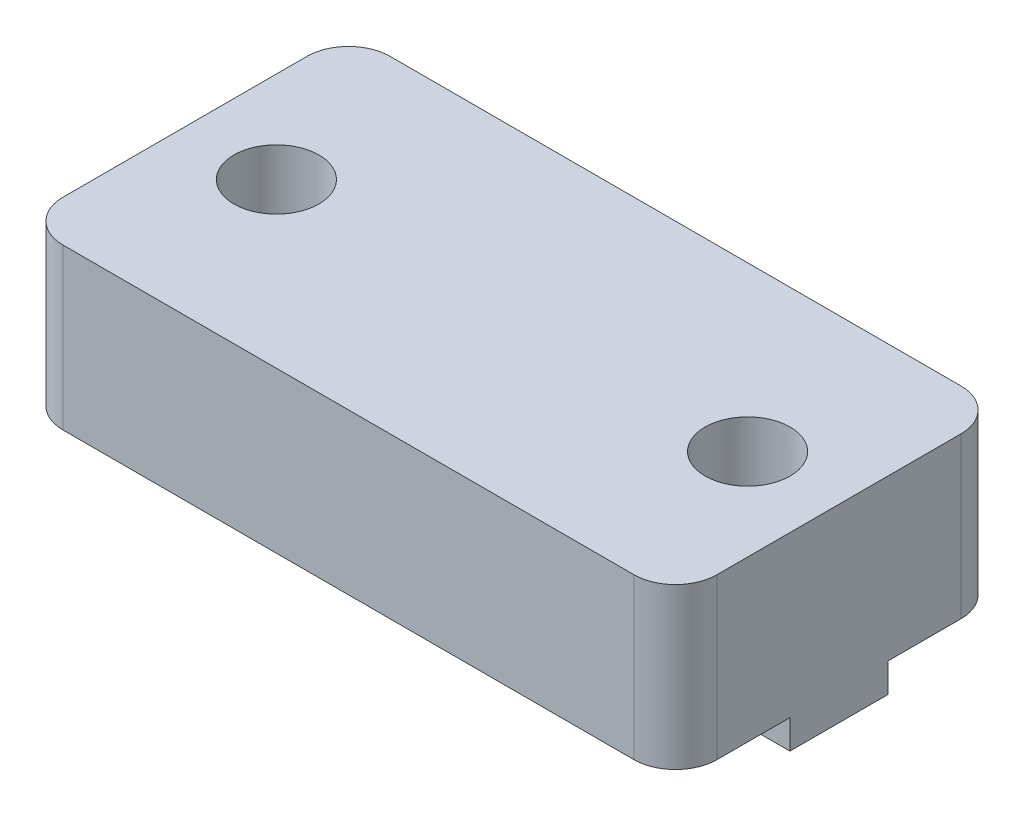
from build123d import *

# Parameters (mm, degrees)
BOSS_EXTRUDE1_DEPTH = 20
SKETCH2_R           = 2.6
CUT_EXTRUDE1_DEPTH  = 11.578
FILLET1_R           = 2.54


with BuildPart() as part:
    # Sketch1 → Boss-Extrude1 (new, symmetric)
    with BuildSketch(Plane(origin=(0, 0, 0), x_dir=(0, 0, -1), z_dir=(1, 0, 0))):
        Polygon((-10, 4.9), (10, 4.9), (10, -4.9), (3, -4.9), (3, -6.678), (-3, -6.678), (-3, -4.9), (-10, -4.9), align=None)
    extrude(amount=BOSS_EXTRUDE1_DEPTH, both=True)

    # Sketch2 → Cut-Extrude1 (cut)
    with BuildSketch(Plane(origin=(0, 4.9, 0), x_dir=(1, 0, 0), z_dir=(0, 1, 0))):
        with Locations(Location((-14.412, 0, 0), (0, 0, 270))):
            Circle(SKETCH2_R)
        with Locations(Location((14.412, 0, 0), (0, 0, 270))):
            Circle(SKETCH2_R)
    extrude(amount=-CUT_EXTRUDE1_DEPTH, mode=Mode.SUBTRACT)

    # Fillet1
    fillet1_edges = [part.edges().sort_by_distance(p)[0] for p in [
        (-20, 0, -10),
        (20, 0, 10),
        (20, 0, -10),
        (-20, 0, 10),
    ]]
    fillet(fillet1_edges, radius=FILLET1_R)


solid = part.part
